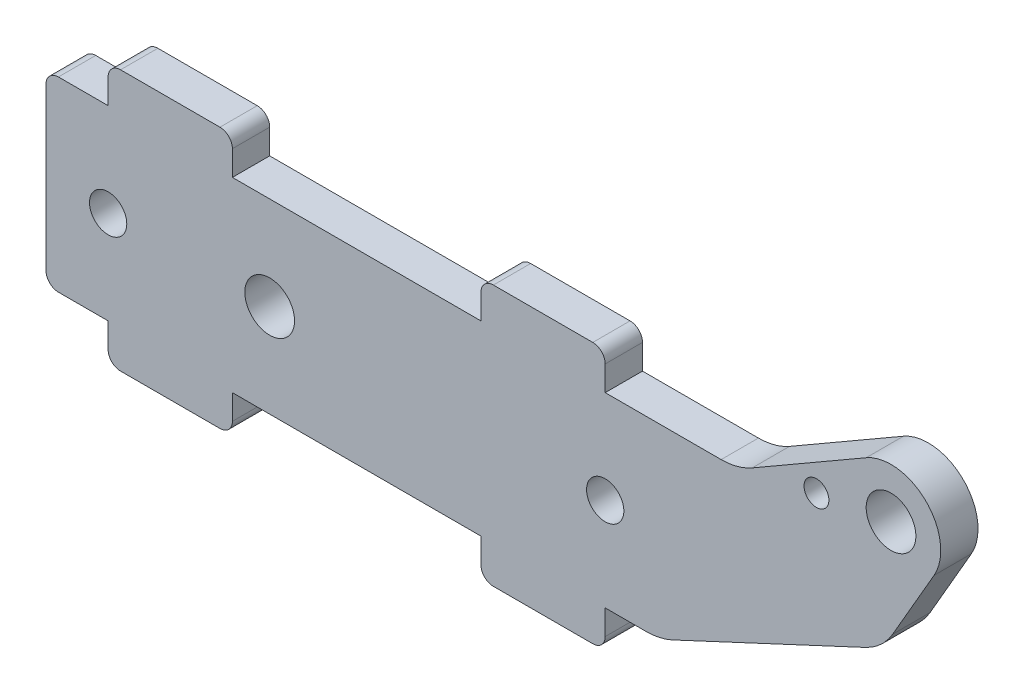
from build123d import *

# Parameters (mm, degrees)
SKETCH_1_R      = 2
SKETCH_1_R_2    = 1.5
SKETCH_1_R_3    = 1
EXTRUDE_1_DEPTH = 3
FILLET_1_R      = 1


with BuildPart() as part:
    # 草图1 → 凸台-拉伸1 (new body)
    with BuildSketch(Plane.XY):
        with BuildLine():
            Line((0, 7.5), (5, 7.5))
            Line((5, 7.5), (5, 10.5))
            Line((5, 10.5), (15, 10.5))
            Line((15, 10.5), (15, 7.5))
            Line((15, 7.5), (35, 7.5))
            Line((35, 7.5), (35, 10.5))
            Line((35, 10.5), (45, 10.5))
            Line((45, 10.5), (45, 7.5))
            Line((45, 7.5), (54.330127019, 7.5))
            ThreePointArc((54.330127019, 7.5), (55.624222244, 7.670370869), (56.830127019, 8.169872981))
            Line((56.830127019, 8.169872981), (66, 13.464101615))
            ThreePointArc((66, 13.464101615), (70.828427125, 12.828427125), (71.464101615, 8))
            Line((71.464101615, 8), (68.134857418, 2.2335799))
            ThreePointArc((68.134857418, 2.2335799), (67.182681437, 1.047193216), (65.917821708, 0.202040965))
            Line((65.917821708, 0.202040965), (50.405359552, -7.031538935))
            ThreePointArc((50.405359552, -7.031538935), (49.374466313, -7.381480036), (48.292268243, -7.5))
            Line((48.292268243, -7.5), (45, -7.5))
            Line((45, -7.5), (45, -10.5))
            Line((45, -10.5), (35, -10.5))
            Line((35, -10.5), (35, -7.5))
            Line((35, -7.5), (15, -7.5))
            Line((15, -7.5), (15, -10.5))
            Line((15, -10.5), (5, -10.5))
            Line((5, -10.5), (5, -7.5))
            Line((5, -7.5), (0, -7.5))
            Line((0, -7.5), (0, 7.5))
        make_face()
        with Locations((68, 10)):
            Circle(SKETCH_1_R, mode=Mode.SUBTRACT)
        with Locations((5, 0)):
            Circle(SKETCH_1_R_2, mode=Mode.SUBTRACT)
        with Locations((45, 0)):
            Circle(SKETCH_1_R_2, mode=Mode.SUBTRACT)
        with Locations((18, 0)):
            Circle(SKETCH_1_R, mode=Mode.SUBTRACT)
        with Locations((62, 9)):
            Circle(SKETCH_1_R_3, mode=Mode.SUBTRACT)
    extrude(amount=EXTRUDE_1_DEPTH)

    # 圆角1
    fillet_1_edges = [part.edges().sort_by_distance(p)[0] for p in [
        (0, 7.5, 1.5),
        (5, 10.5, 1.5),
        (15, 10.5, 1.5),
        (35, 10.5, 1.5),
        (45, 10.5, 1.5),
        (45, -10.5, 1.5),
        (35, -10.5, 1.5),
        (15, -10.5, 1.5),
        (5, -10.5, 1.5),
        (0, -7.5, 1.5),
    ]]
    fillet(fillet_1_edges, radius=FILLET_1_R)


solid = part.part
